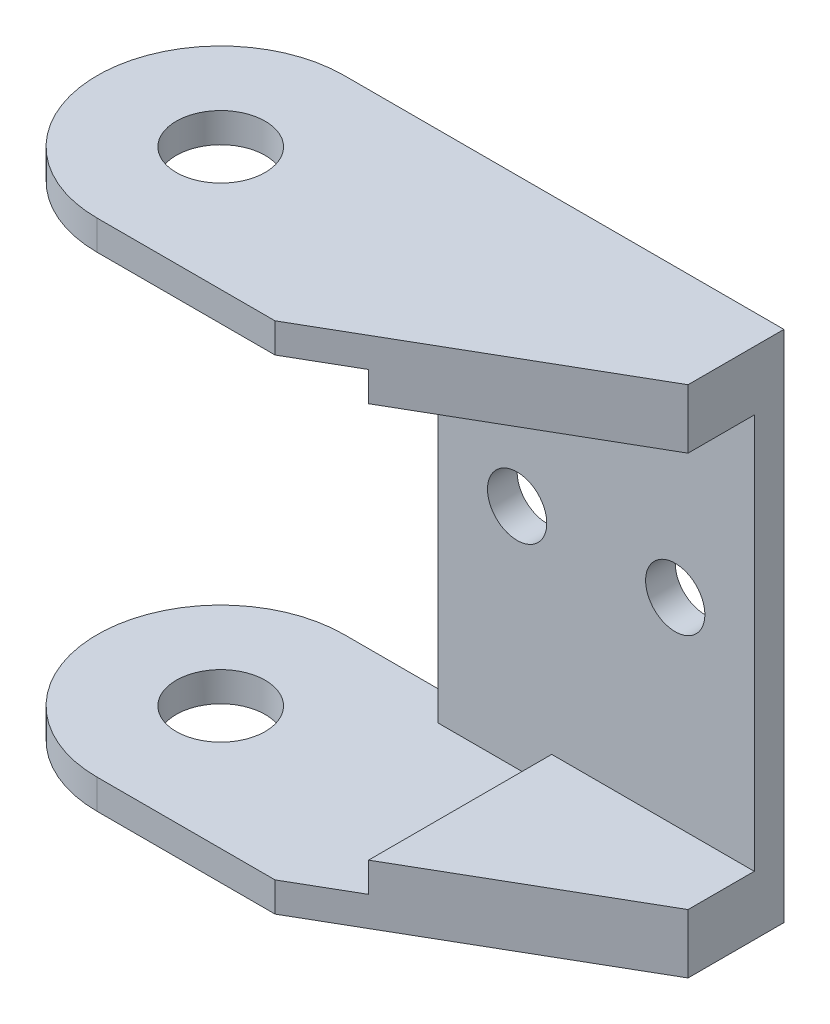
from build123d import *

# Parameters (mm, degrees)
SKETCH1_W                    = 16
SKETCH1_H                    = 20
BOSS_EXTRUDE1_DEPTH          = 1.5
BOSS_EXTRUDE2_DEPTH          = 3
CUT_EXTRUDE1_DEPTH           = 1.5
F_4_5_4_5_DIAMETER_HOLE1_D   = 4.5
F_3_0_3_DIAMETER_HOLE1_D     = 3
F_3_0_3_DIAMETER_HOLE1_DEPTH = 12.5


with BuildPart() as part:
    # Sketch1 → Boss-Extrude1 (new body)
    with BuildSketch(Plane(origin=(0, 0, 0), x_dir=(-1, 0, 0), z_dir=(0, 0, -1))):
        Rectangle(SKETCH1_W, SKETCH1_H)
    extrude(amount=-BOSS_EXTRUDE1_DEPTH)

    # Sketch2 → Boss-Extrude2 (add)
    with BuildSketch(Plane(origin=(0, 10, 0), x_dir=(-1, 0, 0), z_dir=(0, 1, 0))):
        with BuildLine():
            Line((14.25, 0), (-8, 0))
            Line((-8, 0), (-8, 4.850108933))
            Line((-8, 4.850108933), (5.25, 12.5))
            Line((5.25, 12.5), (14.25, 12.5))
            ThreePointArc((14.25, 12.5), (20.5, 6.25), (14.25, 0))
        make_face()
    boss_extrude2 = extrude(amount=BOSS_EXTRUDE2_DEPTH)

    # Mirror1: Boss-Extrude2 across plane
    add(boss_extrude2.mirror(Plane.ZX))

    # Sketch4 → Cut-Extrude1 (cut)
    with BuildSketch(Plane(origin=(0, 10, 0), x_dir=(1, 0, 0), z_dir=(0, 1, 0))):
        Polygon((-20.5, -12.5), (-2.25, -12.5), (-2.25, -1.5), (-8, -1.5), (-8, 0), (-20.5, 0), align=None)
    cut_extrude1 = extrude(amount=CUT_EXTRUDE1_DEPTH, mode=Mode.SUBTRACT)

    # Mirror2: Cut-Extrude1 across plane
    add(cut_extrude1.mirror(Plane.ZX), mode=Mode.SUBTRACT)

    # Ø4.5 (4.5) Diameter Hole1 (through all)
    with Locations(Plane(origin=(0, 13, 0), x_dir=(-1, 0, 0), z_dir=(0, 1, 0))):
        with Locations((14.25, 6.25)):
            f_4_5_4_5_diameter_hole1 = Hole(F_4_5_4_5_DIAMETER_HOLE1_D / 2)

    # Mirror3: Ø4.5 (4.5) Diameter Hole1 across plane
    add(f_4_5_4_5_diameter_hole1.mirror(Plane.ZX), mode=Mode.SUBTRACT)

    # Ø3.0 (3) Diameter Hole1
    with Locations(Plane(origin=(0, 0, 0), x_dir=(-1, 0, 0), z_dir=(0, 0, -1))):
        with Locations((-4, 0), (4, 0)):
            Hole(F_3_0_3_DIAMETER_HOLE1_D / 2, depth=F_3_0_3_DIAMETER_HOLE1_DEPTH)


solid = part.part
